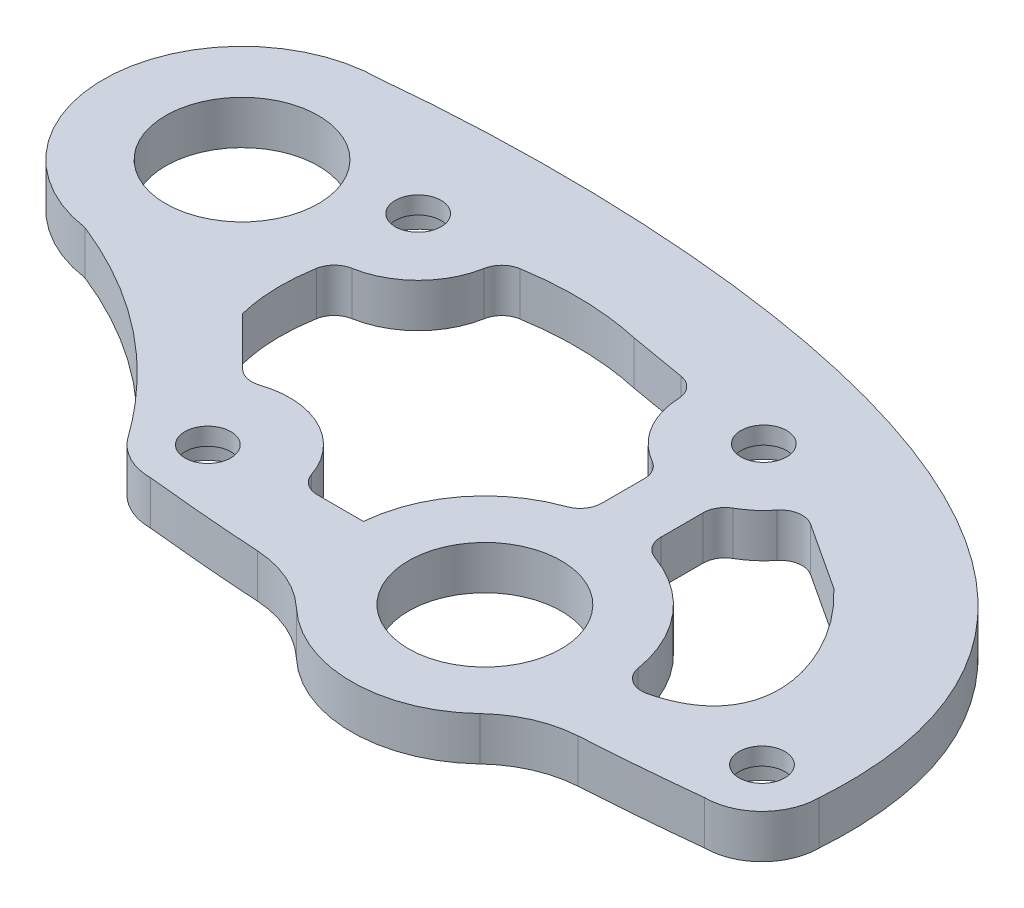
from build123d import *

# Parameters (mm, degrees)
SKETCH1_R           = 2.1
SKETCH1_R_2         = 7
BOSS_EXTRUDE1_DEPTH = 4
FILLET1_R           = 10
SKETCH2_R           = 3.9
CUT_EXTRUDE1_DEPTH  = 2.4
FILLET2_R           = 2


with BuildPart() as part:
    # Sketch1 → Boss-Extrude1 (new body)
    with BuildSketch(Plane(origin=(0, 0, 0), x_dir=(1, 0, 0), z_dir=(0, 1, 0))):
        with BuildLine():
            add(Edge.make_bspline(
                [(-48.276532762, 11.615114404), (-40.793059369, 8.635332343), (-34.627763453, 3.802891886), (-29.780645012, -2.882206965)],
                knots=[0.158174001, 0.158174001, 0.158174001, 0.158174001, 0.985694322, 0.985694322, 0.985694322, 0.985694322], degree=3))
            add(Edge.make_bspline(
                [(-29.780645012, -2.882206965), (-29.696850917, -2.997774969), (-29.613450765, -3.113896649), (-29.530444557, -3.230572003)],
                knots=[0.985694322, 0.985694322, 0.985694322, 0.985694322, 1, 1, 1, 1], degree=3))
            ThreePointArc((-29.530444557, -3.230572003), (-27.697474443, -4.713679973), (-25.4, -5.243774185))
            add(Edge.make_bspline(
                [(-25.4, -5.243774185), (-17.91803421, -6.039173757), (-10.43606842, -6.365978653)],
                knots=[0, 0, 0, 0.294565582, 0.294565582, 0.294565582], degree=2))
            ThreePointArc((-10.43606842, -6.365978653), (0, -12.224451247), (10.43606842, -6.365978653))
            add(Edge.make_bspline(
                [(10.43606842, -6.365978653), (17.918034209, -6.039173757), (25.4, -5.243774185)],
                knots=[0.705434418, 0.705434418, 0.705434418, 1, 1, 1], degree=2))
            ThreePointArc((25.4, -5.243774185), (29.107908285, -3.707908285), (30.643774185, 0))
            add(Edge.make_bspline(
                [(-46.474516908, 36.934762739), (-23.164206568, 39.351897946), (33.373901801, 38.120150773), (30.643774185, 0)],
                knots=[0, 0, 0, 0, 1, 1, 1, 1], degree=3))
            ThreePointArc((-46.474516908, 36.934762739), (-59.166363236, 25.114100216), (-48.276532762, 11.615114404))
        make_face()
        with Locations(Location((-25.4, 0, 0), (0, 0, 270))):
            Circle(SKETCH1_R, mode=Mode.SUBTRACT)
        with Locations(Location((0, 0, 0), (0, 0, 270))):
            Circle(SKETCH1_R_2, mode=Mode.SUBTRACT)
        with Locations(Location((25.4, 0, 0), (0, 0, 270))):
            Circle(SKETCH1_R, mode=Mode.SUBTRACT)
        with BuildLine():
            Line((6.818861244, 22.448276617), (14.692223791, 17.296643593))
            add(Edge.make_bspline(
                [(14.692223791, 17.296643593), (20.936611379, 11.517843997), (24.015411048, 1.179452343), (12.224451247, 0)],
                knots=[0.294731971, 0.294731971, 0.294731971, 0.294731971, 1, 1, 1, 1], degree=3))
            ThreePointArc((12.224451247, 0), (9.551728824, 7.629002869), (2.702275798, 11.922034801))
            Line((2.702275798, 11.922034801), (2.702275798, 18.575013303))
            ThreePointArc((2.702275798, 18.575013303), (5.139411914, 20.10900226), (6.818861244, 22.448276617))
        make_face(mode=Mode.SUBTRACT)
        with Locations(Location((-46.474516908, 24.210813251, 0), (0, 0, 270))):
            Circle(SKETCH1_R_2, mode=Mode.SUBTRACT)
        with BuildLine():
            add(Edge.make_bspline(
                [(-26.616347467, 28.001234406), (-23.355822424, 28.704578443), (-20.160458878, 28.867528343), (-17.03025683, 28.490084106)],
                knots=[0, 0, 0, 0, 0.490853217, 0.490853217, 0.490853217, 0.490853217], degree=3))
            add(Edge.make_bspline(
                [(-17.03025683, 28.490084106), (-16.127682529, 28.381250406), (-15.230525893, 28.227487183), (-14.338786924, 28.028794436)],
                knots=[0.490853217, 0.490853217, 0.490853217, 0.490853217, 0.632387691, 0.632387691, 0.632387691, 0.632387691], degree=3))
            Line((-14.338786924, 28.028794436), (-7.392215006, 26.83822498))
            ThreePointArc((-7.392215006, 26.83822498), (-6.522641563, 21.869230657), (-2.702275798, 18.575013303))
            Line((-2.702275798, 18.575013303), (-2.702275798, 11.922034801))
            ThreePointArc((-2.702275798, 11.922034801), (-9.215350555, 8.032093278), (-12.179376812, 1.048803495))
            Line((-12.179376812, 1.048803495), (-17.973694645, 1.048803495))
            ThreePointArc((-17.973694645, 1.048803495), (-21.967394814, 6.668374737), (-28.861522607, 6.653409745))
            Line((-28.861522607, 6.653409745), (-34.221790482, 12.01367762))
            add(Edge.make_bspline(
                [(-34.116347467, 20.501234406), (-35.2187538, 15.994576363), (-34.221790482, 12.01367762)],
                knots=[0, 0, 0, 0.526441047, 0.526441047, 0.526441047], degree=2))
            ThreePointArc((-34.116347467, 20.501234406), (-28.813046608, 22.697933547), (-26.616347467, 28.001234406))
        make_face(mode=Mode.SUBTRACT)
        with Locations(Location((-34.116347467, 28.001234406, 0), (0, 0, 270))):
            Circle(SKETCH1_R, mode=Mode.SUBTRACT)
        with Locations(Location((0, 25.57127698, 0), (0, 0, 270))):
            Circle(SKETCH1_R, mode=Mode.SUBTRACT)
    extrude(amount=BOSS_EXTRUDE1_DEPTH)

    # Fillet1
    fillet1_edges = [part.edges().sort_by_distance(p)[0] for p in [
        (10.43606842, 2, 6.365978653),
        (-10.43606842, 2, 6.365978653),
    ]]
    fillet(fillet1_edges, radius=FILLET1_R)

    # Sketch2 → Cut-Extrude1 (cut)
    with BuildSketch(Plane.XZ):
        with Locations(Location((0, -25.57127698, 0), (0, 0, 270))):
            Circle(SKETCH2_R)
        with Locations(Location((25.4, 0, 0), (0, 0, 270))):
            Circle(SKETCH2_R)
        with Locations(Location((-25.4, 0, 0), (0, 0, 270))):
            Circle(SKETCH2_R)
        with Locations(Location((-34.116347467, -28.001234406, 0), (0, 0, 270))):
            Circle(SKETCH2_R)
    extrude(amount=-CUT_EXTRUDE1_DEPTH, mode=Mode.SUBTRACT)

    # Fillet2
    fillet2_edges = [part.edges().sort_by_distance(p)[0] for p in [
        (-7.392215006, 2, -26.83822498),
        (-26.616347467, 2, -28.001234406),
        (-28.861522607, 2, -6.653409745),
        (-17.973694645, 2, -1.048803495),
        (12.224451247, 2, 0),
        (-34.116347467, 2, -20.501234406),
        (2.702275798, 2, -11.922034801),
        (2.702275798, 2, -18.575013303),
        (6.818861244, 2, -22.448276617),
        (-2.702275798, 2, -11.922034801),
        (-2.702275798, 2, -18.575013303),
    ]]
    fillet(fillet2_edges, radius=FILLET2_R)


solid = part.part
